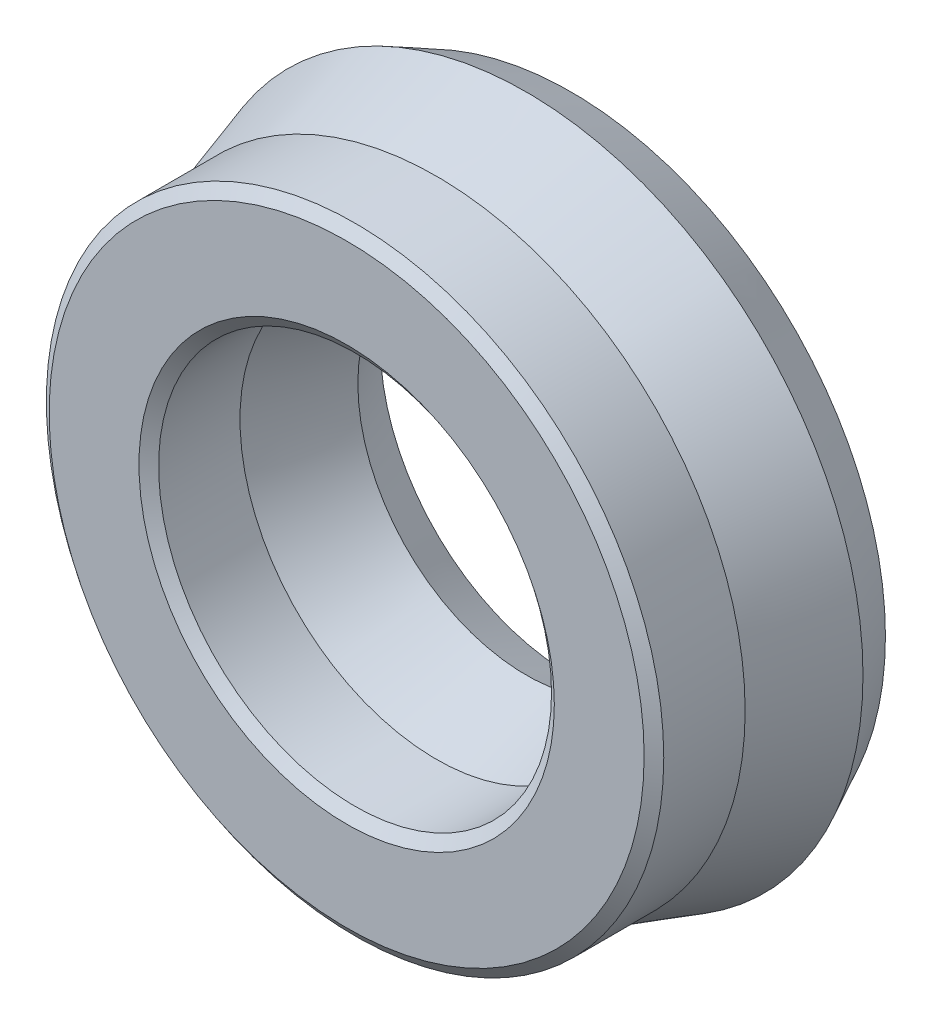
from build123d import *


with BuildPart() as part:
    # Sketch2 → Revolve1 (revolve)
    with BuildSketch(Plane(origin=(0, 0, 0), x_dir=(0, 0, -1), z_dir=(1, 0, 0)), mode=Mode.PRIVATE) as revolve1_sk:
        with BuildLine():
            Line((0.024688303, 1.555426785), (0.024688303, 1.055426785))
            Line((0.024688303, 1.055426785), (-1.341325441, 0.598364979))
            ThreePointArc((-1.341325441, 0.598364979), (-1.436030164, 0.45504575), (-1.341325441, 0.31172652))
            Line((-1.341325441, 0.31172652), (0.024688303, -0.145335285))
            Line((0.024688303, -0.145335285), (0.024688303, -0.644573215))
            Line((0.024688303, -0.644573215), (-0.775311697, -1.044573215))
            Line((-0.775311697, -1.044573215), (-2.375311697, -0.54495425))
            Line((-2.375311697, -0.54495425), (-3.825311697, -0.54495425))
            Line((-3.825311697, -0.54495425), (-3.975311697, -0.34495425))
            Line((-3.975311697, -0.34495425), (-3.975311697, 1.25504575))
            Line((-3.975311697, 1.25504575), (-3.825311697, 1.45504575))
            Line((-3.825311697, 1.45504575), (-2.375311697, 1.45504575))
            Line((-2.375311697, 1.45504575), (-0.7754582, 1.955133643))
            Line((-0.7754582, 1.955133643), (0.024688303, 1.555426785))
        make_face()
    revolve(revolve1_sk.sketch.rotate(Axis((0, 4.955426785, 17.313384256), (0, 0, -1)), 270), axis=Axis((0, 4.955426785, 17.313384256), (0, 0, -1)))


solid = part.part
